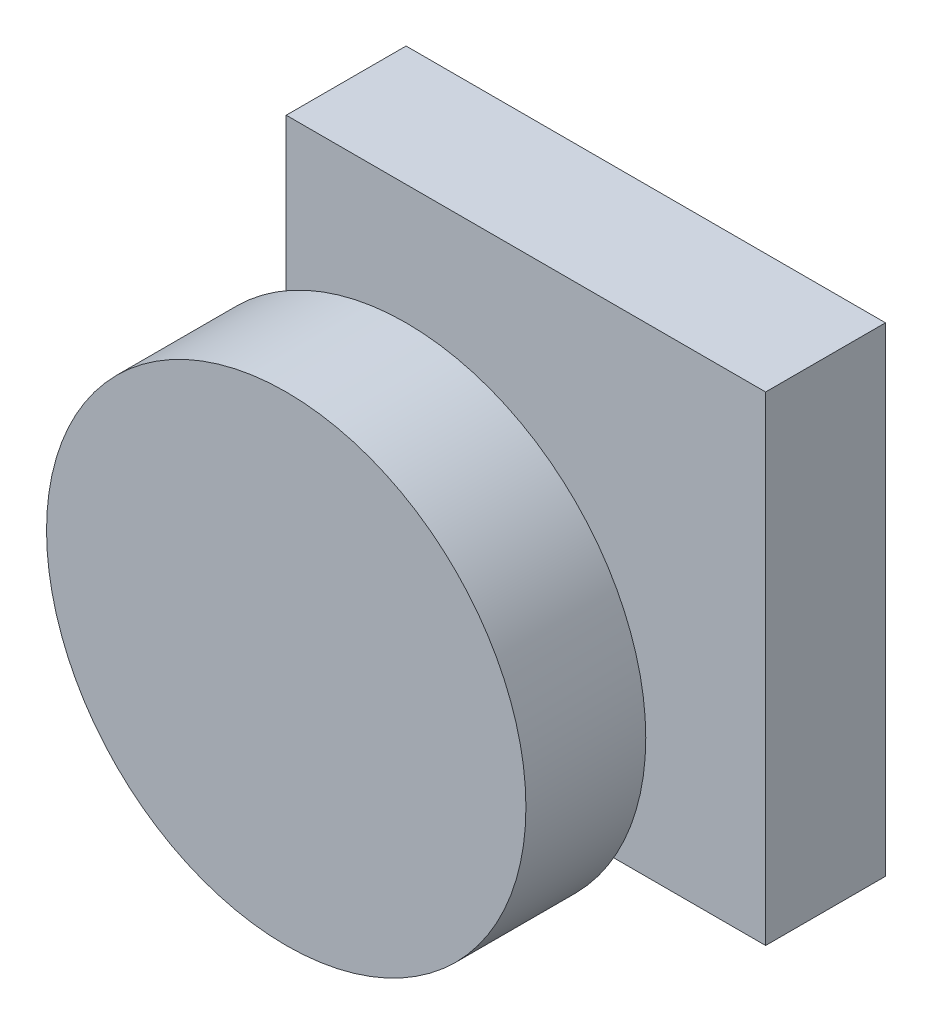
from build123d import *

# Parameters (mm, degrees)
SKETCH_1_W      = 4
SKETCH_1_H      = 4
EXTRUDE_1_DEPTH = 1
SKETCH_2_R      = 0.4
EXTRUDE_2_DEPTH = 1
SKETCH_3_R      = 2
EXTRUDE_3_DEPTH = 1


with BuildPart() as part:
    # 草圖1 → 填料-伸長1 (new body)
    with BuildSketch(Plane.XY):
        Rectangle(SKETCH_1_W, SKETCH_1_H)
    extrude(amount=EXTRUDE_1_DEPTH)

    # 草圖2 → 填料-伸長2 (add)
    with BuildSketch(Plane.XY.offset(1)):
        Circle(SKETCH_2_R)
    extrude(amount=EXTRUDE_2_DEPTH)

    # 草圖3 → 填料-伸長3 (add)
    with BuildSketch(Plane.XY.offset(2)):
        Circle(SKETCH_3_R)
    extrude(amount=EXTRUDE_3_DEPTH)


solid = part.part
